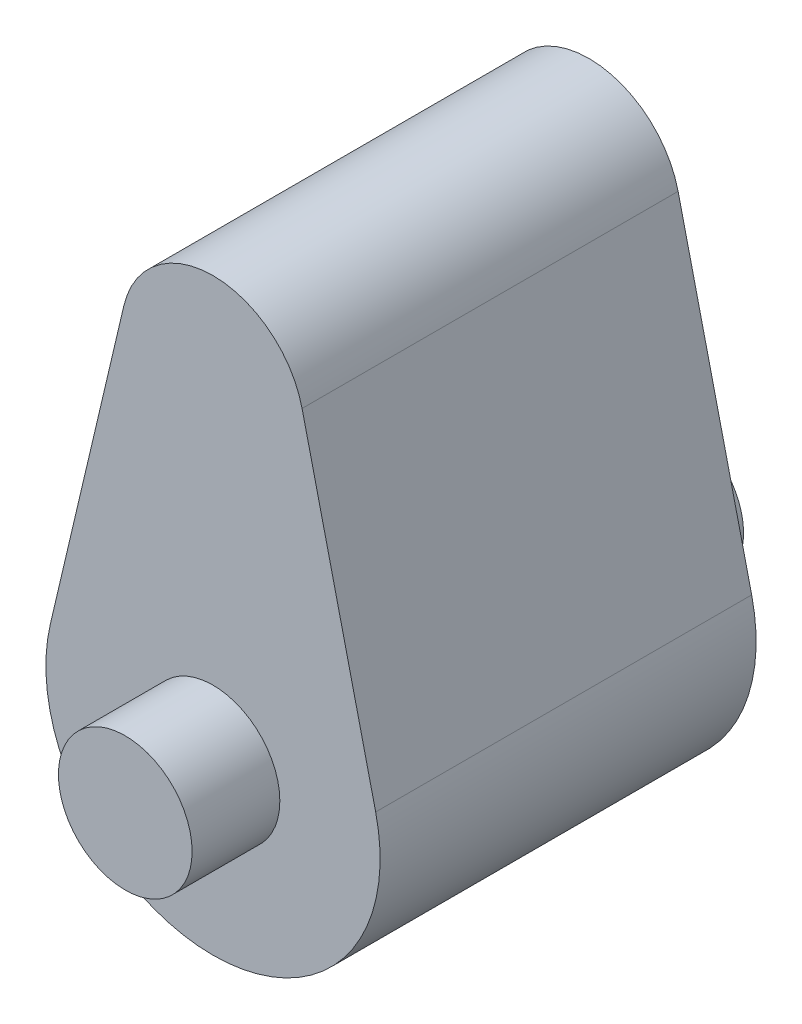
from build123d import *

# Parameters (mm, degrees)
SKETCH1_R           = 8
BOSS_EXTRUDE1_DEPTH = 66
BOSS_EXTRUDE2_DEPTH = 22.5


with BuildPart() as part:
    # Sketch1 → Boss-Extrude1 (new body)
    with BuildSketch(Plane.XY):
        Circle(SKETCH1_R)
    extrude(amount=BOSS_EXTRUDE1_DEPTH)

    # Sketch2 → Boss-Extrude2 (add, symmetric)
    with BuildSketch(Plane.XY.offset(33)):
        with BuildLine():
            Line((-10.662181086, 42.002247261), (-19.468214294, 4.581335198))
            ThreePointArc((-19.468214294, 4.581335198), (0, -20), (19.468214294, 4.581335198))
            Line((19.468214294, 4.581335198), (10.662181086, 42.002247261))
            ThreePointArc((10.662181086, 42.002247261), (0, 50.44660655), (-10.662181086, 42.002247261))
        make_face()
    extrude(amount=BOSS_EXTRUDE2_DEPTH, both=True)


solid = part.part
